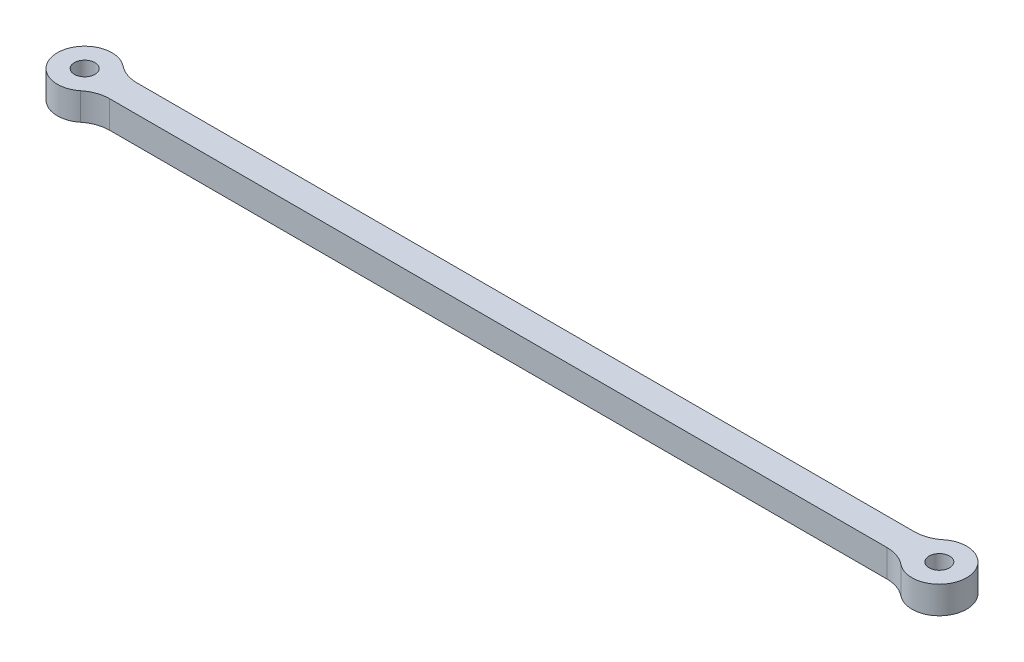
from build123d import *

# Parameters (mm, degrees)
SKETCH_1_R      = 3
EXTRUDE_1_DEPTH = 8
FILLET_1_R      = 10


with BuildPart() as part:
    # 草图1 → 凸台-拉伸1 (new body)
    with BuildSketch(Plane(origin=(0, 0, 0), x_dir=(1, 0, 0), z_dir=(0, 1, 0))):
        with BuildLine():
            Line((6.92820323, 4), (243.07179677, 4))
            ThreePointArc((243.07179677, 4), (258, 0), (243.07179677, -4))
            Line((243.07179677, -4), (6.92820323, -4))
            ThreePointArc((6.92820323, -4), (-8, 0), (6.92820323, 4))
        make_face()
        with Locations(Location((0, 0, 0), (0, 0, 270))):
            Circle(SKETCH_1_R, mode=Mode.SUBTRACT)
        with Locations(Location((250, 0, 0), (0, 0, 270))):
            Circle(SKETCH_1_R, mode=Mode.SUBTRACT)
    extrude(amount=EXTRUDE_1_DEPTH)

    # 圆角1
    fillet_1_edges = [part.edges().sort_by_distance(p)[0] for p in [
        (243.07179677, 4, 4),
        (6.92820323, 4, 4),
        (6.92820323, 4, -4),
        (243.07179677, 4, -4),
    ]]
    fillet(fillet_1_edges, radius=FILLET_1_R)


solid = part.part
